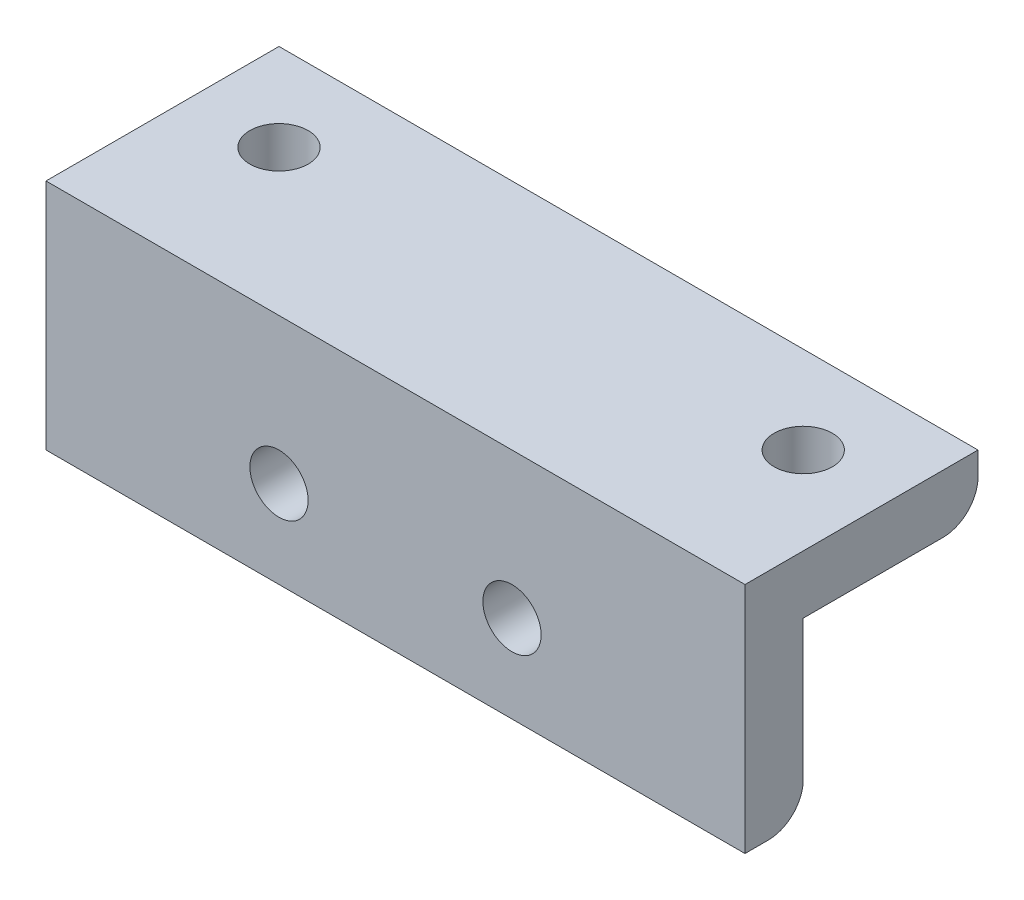
from build123d import *

# Parameters (mm, degrees)
BOSS_EXTRUDE1_DEPTH = 76.2
FILLET2_R           = 3.81
SKETCH2_R           = 3.175
CUT_EXTRUDE1_DEPTH  = 76.2
SKETCH3_R           = 3.175
CUT_EXTRUDE2_DEPTH  = 76.2


with BuildPart() as part:
    # Sketch1 → Boss-Extrude1 (new body)
    with BuildSketch(Plane(origin=(0, 0, 0), x_dir=(0, 0, -1), z_dir=(1, 0, 0))):
        Polygon((0.026896594, 23.297964889), (-25.373103406, 23.297964889), (-25.373103406, -2.102035111), (-19.023103406, -2.102035111), (-19.023103406, 16.947964889), (0.026896594, 16.947964889), align=None)
    extrude(amount=BOSS_EXTRUDE1_DEPTH)

    # Fillet2
    fillet2_edges = [part.edges().sort_by_distance(p)[0] for p in [
        (38.1, 16.947964889, -0.026896594),
        (38.1, -2.102035111, 19.023103406),
    ]]
    fillet(fillet2_edges, radius=FILLET2_R)

    # Sketch2 → Cut-Extrude1 (cut)
    with BuildSketch(Plane(origin=(0, 23.297964889, 0), x_dir=(1, 0, 0), z_dir=(0, 1, 0))):
        with Locations(Location((9.525, -9.498103406, 0), (0, 0, 270))):
            Circle(SKETCH2_R)
        with Locations(Location((66.675, -9.498103406, 0), (0, 0, 270))):
            Circle(SKETCH2_R)
    extrude(amount=-CUT_EXTRUDE1_DEPTH, mode=Mode.SUBTRACT)

    # Sketch3 → Cut-Extrude2 (cut)
    with BuildSketch(Plane.XY.offset(25.373103406)):
        with Locations((25.4, 7.422964889)):
            Circle(SKETCH3_R)
        with Locations((50.8, 7.422964889)):
            Circle(SKETCH3_R)
    extrude(amount=-CUT_EXTRUDE2_DEPTH, mode=Mode.SUBTRACT)


solid = part.part
